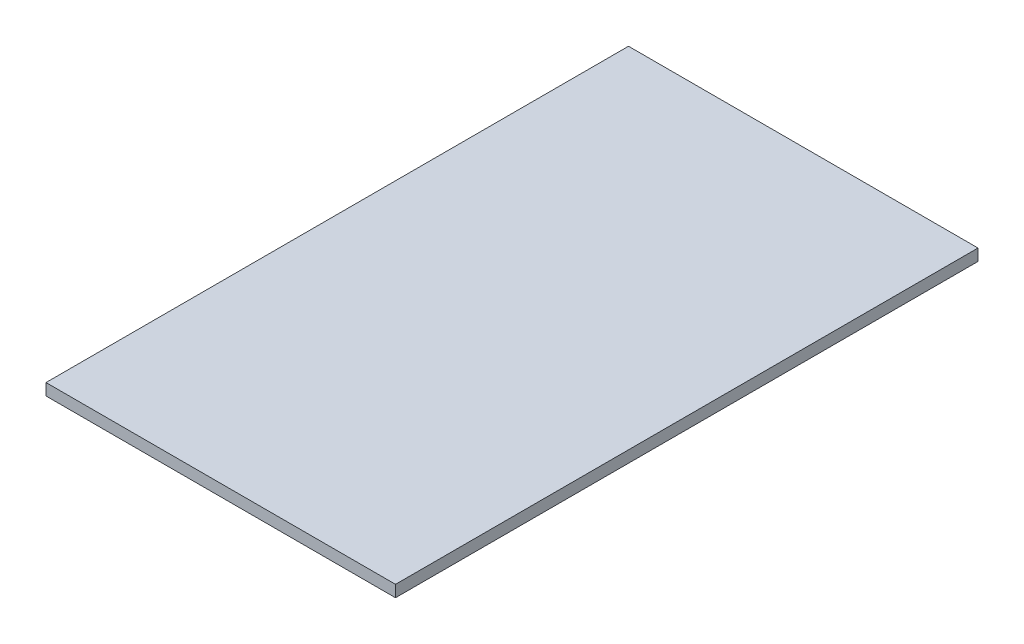
from build123d import *

# Parameters (mm, degrees)
SKETCH1_W           = 76.2
SKETCH1_H           = 127
BOSS_EXTRUDE1_DEPTH = 2.54


with BuildPart() as part:
    # Sketch1 → Boss-Extrude1 (new body)
    with BuildSketch(Plane(origin=(0, 0, 0), x_dir=(1, 0, 0), z_dir=(0, 1, 0))):
        Rectangle(SKETCH1_W, SKETCH1_H)
    extrude(amount=BOSS_EXTRUDE1_DEPTH)


solid = part.part
